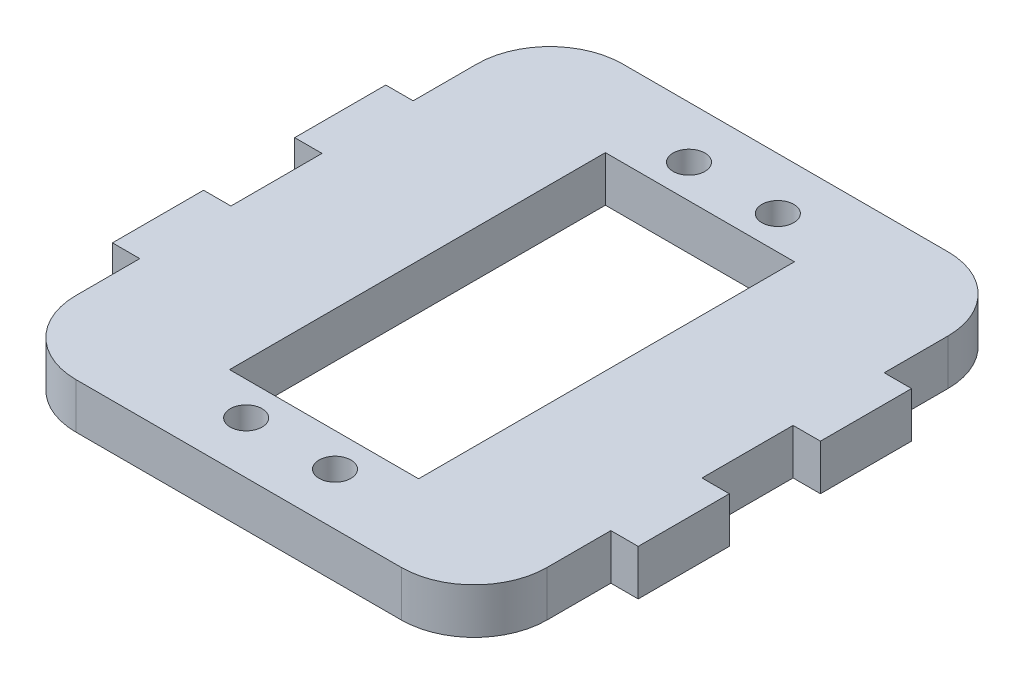
from build123d import *

# Parameters (mm, degrees)
SKETCH_1_R      = 1.75
SKETCH_1_W      = 20.75
SKETCH_1_H      = 41.25
EXTRUDE_1_DEPTH = 5
FILLET_1_R      = 8


with BuildPart() as part:
    # 草图1 → 凸台-拉伸1 (new body)
    with BuildSketch(Plane(origin=(0, 0, 0), x_dir=(1, 0, 0), z_dir=(0, 1, 0))):
        Polygon((25.85, -30), (-25.85, -30), (-25.85, -15), (-28.85, -15), (-28.85, -5), (-25.85, -5), (-25.85, 5), (-28.85, 5), (-28.85, 15), (-25.85, 15), (-25.85, 30), (25.85, 30), (25.85, 15), (28.85, 15), (28.85, 5), (25.85, 5), (25.85, -5), (28.85, -5), (28.85, -15), (25.85, -15), align=None)
        with Locations(Location((-4.875, -24.3, 0), (0, 0, 270))):
            Circle(SKETCH_1_R, mode=Mode.SUBTRACT)
        with Locations(Location((4.875, -24.3, 0), (0, 0, 90))):
            Circle(SKETCH_1_R, mode=Mode.SUBTRACT)
        with Locations(Location((4.875, 24.3, 0), (0, 0, 270))):
            Circle(SKETCH_1_R, mode=Mode.SUBTRACT)
        with Locations(Location((-4.875, 24.3, 0), (0, 0, 90))):
            Circle(SKETCH_1_R, mode=Mode.SUBTRACT)
        Rectangle(SKETCH_1_W, SKETCH_1_H, mode=Mode.SUBTRACT)
    extrude(amount=EXTRUDE_1_DEPTH)

    # 圆角1
    fillet_1_edges = [part.edges().sort_by_distance(p)[0] for p in [
        (-25.85, 2.5, -30),
        (25.85, 2.5, -30),
        (25.85, 2.5, 30),
        (-25.85, 2.5, 30),
    ]]
    fillet(fillet_1_edges, radius=FILLET_1_R)


solid = part.part
